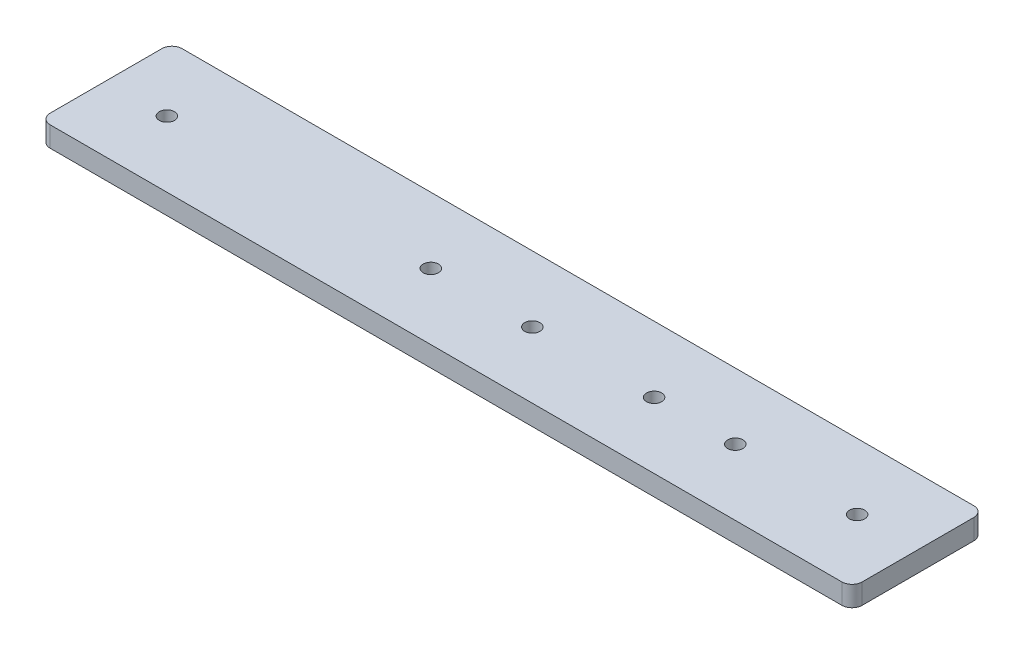
from build123d import *

# Parameters (mm, degrees)
SKETCH1_W           = 400
SKETCH1_H           = 65
SKETCH1_R           = 3.75
BOSS_EXTRUDE1_DEPTH = 10
FILLET1_R           = 5


with BuildPart() as part:
    # Sketch1 → Boss-Extrude1 (new body)
    with BuildSketch(Plane(origin=(0, 0, 0), x_dir=(1, 0, 0), z_dir=(0, 1, 0))):
        Rectangle(SKETCH1_W, SKETCH1_H)
        with Locations(Location((-170, 0, 0), (0, 0, 270))):
            Circle(SKETCH1_R, mode=Mode.SUBTRACT)
        with Locations(Location((-40, 0, 0), (0, 0, 270))):
            Circle(SKETCH1_R, mode=Mode.SUBTRACT)
        with Locations(Location((10, 0, 0), (0, 0, 270))):
            Circle(SKETCH1_R, mode=Mode.SUBTRACT)
        with Locations(Location((70, 0, 0), (0, 0, 270))):
            Circle(SKETCH1_R, mode=Mode.SUBTRACT)
        with Locations(Location((110, 0, 0), (0, 0, 270))):
            Circle(SKETCH1_R, mode=Mode.SUBTRACT)
        with Locations(Location((170, 0, 0), (0, 0, 270))):
            Circle(SKETCH1_R, mode=Mode.SUBTRACT)
    extrude(amount=BOSS_EXTRUDE1_DEPTH)

    # Fillet1
    fillet1_edges = [part.edges().sort_by_distance(p)[0] for p in [
        (-200, 5, -32.5),
        (200, 5, -32.5),
        (200, 5, 32.5),
        (-200, 5, 32.5),
    ]]
    fillet(fillet1_edges, radius=FILLET1_R)


solid = part.part
